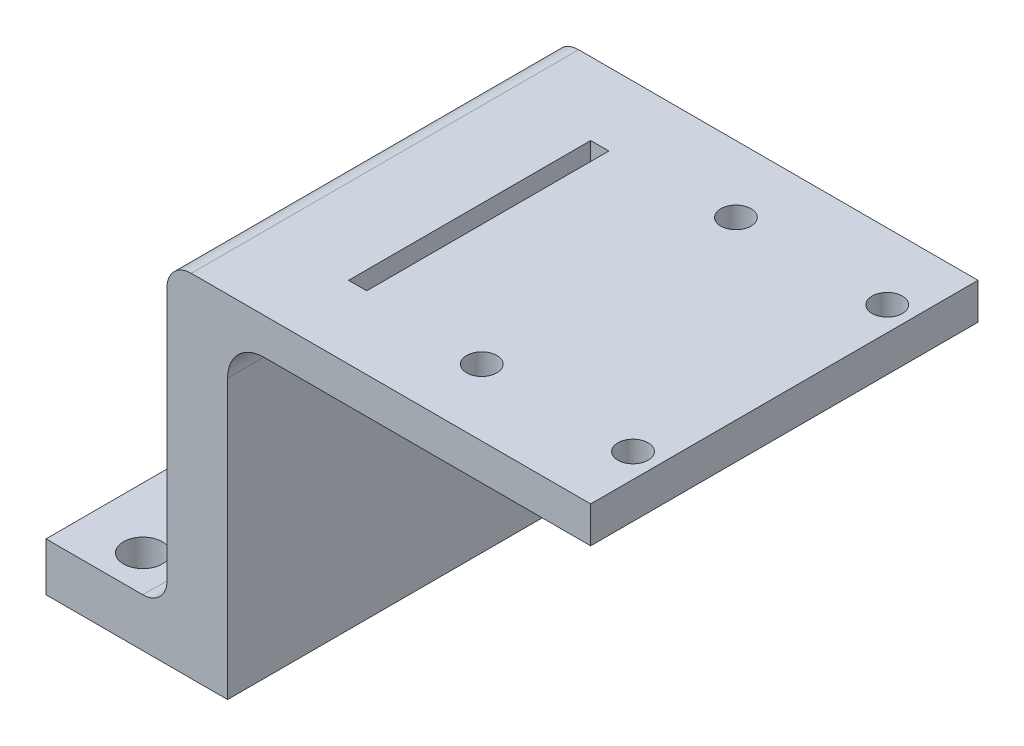
from build123d import *

# Parameters (mm, degrees)
SKETCH1_W           = 10
SKETCH1_H           = 32
SKETCH1_R           = 1.6
BOSS_EXTRUDE1_DEPTH = 4
SKETCH2_W           = 32
SKETCH2_H           = 4
BOSS_EXTRUDE2_DEPTH = 5
SKETCH3_W           = 5
SKETCH3_H           = 32
BOSS_EXTRUDE3_DEPTH = 25
FILLET1_R           = 2
SKETCH4_W           = 32
SKETCH4_H           = 3
BOSS_EXTRUDE4_DEPTH = 30
SKETCH5_R           = 1.25
CUT_EXTRUDE1_DEPTH  = 25
FILLET2_R           = 2
FILLET3_R           = 3
SKETCH7_W           = 1.5
SKETCH7_H           = 20
CUT_EXTRUDE2_DEPTH  = 10


with BuildPart() as part:
    # Sketch1 → Boss-Extrude1 (new body)
    with BuildSketch(Plane(origin=(0, 0, 0), x_dir=(1, 0, 0), z_dir=(0, 1, 0))):
        Rectangle(SKETCH1_W, SKETCH1_H)
        with Locations(Location((0, -13, 0), (0, 0, 270))):
            Circle(SKETCH1_R, mode=Mode.SUBTRACT)
        with Locations(Location((0, 13, 0), (0, 0, 270))):
            Circle(SKETCH1_R, mode=Mode.SUBTRACT)
    extrude(amount=BOSS_EXTRUDE1_DEPTH)

    # Sketch2 → Boss-Extrude2 (add)
    with BuildSketch(Plane(origin=(5, 0, 0), x_dir=(0, 0, -1), z_dir=(1, 0, 0))):
        with Locations((0, 2)):
            Rectangle(SKETCH2_W, SKETCH2_H)
    extrude(amount=BOSS_EXTRUDE2_DEPTH)

    # Sketch3 → Boss-Extrude3 (add)
    with BuildSketch(Plane(origin=(0, 4, 0), x_dir=(1, 0, 0), z_dir=(0, 1, 0))):
        with Locations((7.5, 0)):
            Rectangle(SKETCH3_W, SKETCH3_H)
    extrude(amount=BOSS_EXTRUDE3_DEPTH)

    # Fillet1
    fillet1_edges = [part.edges().sort_by_distance(p)[0] for p in [
        (5, 4, 0),
    ]]
    fillet(fillet1_edges, radius=FILLET1_R)

    # Sketch4 → Boss-Extrude4 (add)
    with BuildSketch(Plane(origin=(10, 0, 0), x_dir=(0, 0, -1), z_dir=(1, 0, 0))):
        with Locations((0, 27.5)):
            Rectangle(SKETCH4_W, SKETCH4_H)
    extrude(amount=BOSS_EXTRUDE4_DEPTH)

    # Sketch5 → Cut-Extrude1 (cut)
    with BuildSketch(Plane(origin=(0, 29, 0), x_dir=(1, 0, 0), z_dir=(0, 1, 0))):
        with Locations(Location((38, -10.5, 0), (0, 0, 270))):
            Circle(SKETCH5_R)
        with Locations(Location((38, 10.5, 0), (0, 0, 270))):
            Circle(SKETCH5_R)
        with Locations(Location((25.5, 10.5, 0), (0, 0, 270))):
            Circle(SKETCH5_R)
        with Locations(Location((25.5, -10.5, 0), (0, 0, 270))):
            Circle(SKETCH5_R)
    extrude(amount=-CUT_EXTRUDE1_DEPTH, mode=Mode.SUBTRACT)

    # Fillet2
    fillet2_edges = [part.edges().sort_by_distance(p)[0] for p in [
        (5, 29, 0),
    ]]
    fillet(fillet2_edges, radius=FILLET2_R)

    # Fillet3
    fillet3_edges = [part.edges().sort_by_distance(p)[0] for p in [
        (10, 26, 0),
    ]]
    fillet(fillet3_edges, radius=FILLET3_R)

    # Sketch7 → Cut-Extrude2 (cut)
    with BuildSketch(Plane.XZ.offset(-26)):
        with Locations((14.75, 0)):
            Rectangle(SKETCH7_W, SKETCH7_H)
    extrude(amount=-CUT_EXTRUDE2_DEPTH, mode=Mode.SUBTRACT)


solid = part.part
